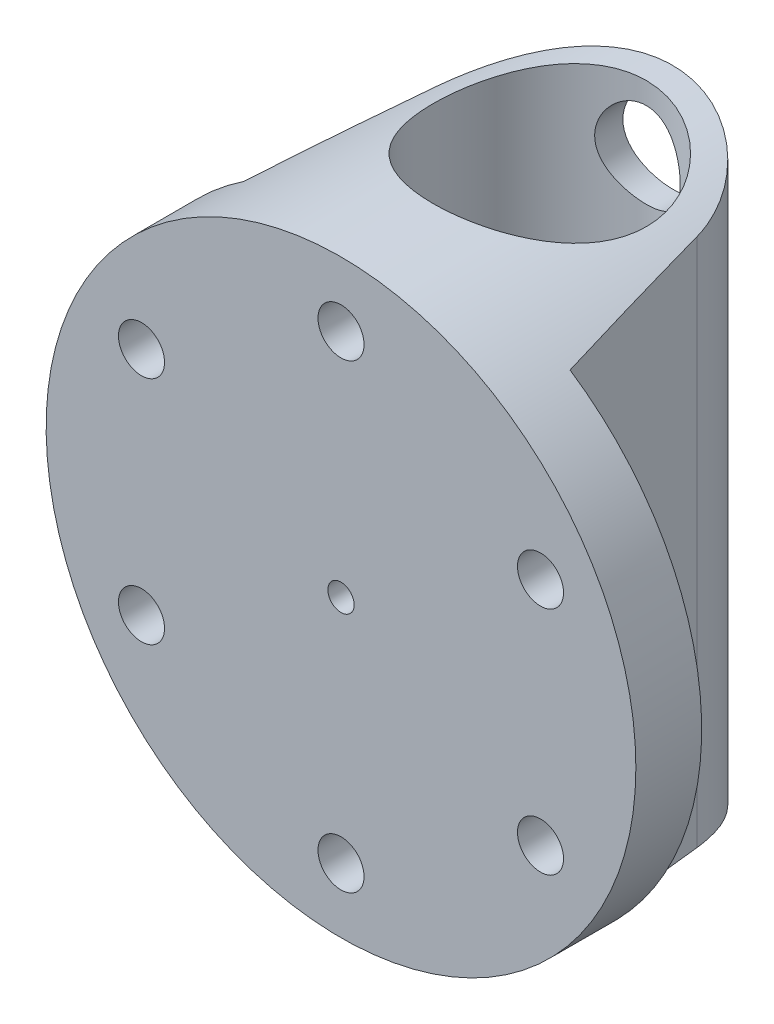
from build123d import *

# Parameters (mm, degrees)
SKETCH1_R                       = 22.4
BOSS_EXTRUDE1_DEPTH             = 5
BOSS_EXTRUDE2_REACH             = 34.071
BOSS_EXTRUDE2_END_RADIUS        = 22.4
SKETCH3_R                       = 8.1
BOSS_EXTRUDE2_DIRECTION_2_DEPTH = 18
BOSS_EXTRUDE5_START             = 21
BOSS_EXTRUDE5_DEPTH             = 21
CUT_EXTRUDE2_START              = -21
CUT_EXTRUDE2_DEPTH              = 21
SKETCH2_R                       = 1.75
CUT_EXTRUDE1_DEPTH              = 41.479130543
CUT_EXTRUDE3_DEPTH              = 21
CUT_EXTRUDE3_DEPTH_BACK         = 1.5
SKETCH7_R                       = 3.25
SKETCH7_R_2                     = 1.75
SKETCH8_R                       = 1
CUT_EXTRUDE4_DEPTH              = 41.479130543


with BuildPart() as part:
    # Sketch1 → Boss-Extrude1 (new body)
    with BuildSketch(Plane.XY):
        Circle(SKETCH1_R)
    extrude(amount=BOSS_EXTRUDE1_DEPTH)



with BuildPart() as body_2:
    # Boss-Extrude2: up to this cylinder (the profile starts inside it)
    boss_extrude2_end = Plane(origin=(0, 0, -6.007051), z_dir=(0, 0, -1)) * Cylinder(BOSS_EXTRUDE2_END_RADIUS, 113.942, mode=Mode.PRIVATE)
    # Sketch3 → Boss-Extrude2 (new, up to the surface)
    with BuildSketch(Plane(origin=(0, 0, 0), x_dir=(1, 0, 0), z_dir=(0, 1, 0)), mode=Mode.PRIVATE) as boss_extrude2_sk1:
        with BuildLine():
            Line((-9.89110529, 12.143535207), (-12.4, 0))
            Line((-12.4, 0), (12.4, 0))
            Line((12.4, 0), (9.89110529, 12.143535207))
            ThreePointArc((9.89110529, 12.143535207), (0, 20.2), (-9.89110529, 12.143535207))
        make_face()
        with Locations(Location((0, 10.1, 0), (0, 0, 270))):
            Circle(SKETCH3_R, mode=Mode.SUBTRACT)
    boss_extrude2_tool1 = extrude(boss_extrude2_sk1.sketch, amount=BOSS_EXTRUDE2_REACH, mode=Mode.PRIVATE) & boss_extrude2_end
    add(boss_extrude2_tool1.solids().sort_by_distance((-10.832312, 0, -6.007051))[0])

    # Sketch3 → Boss-Extrude2 direction 2 (add)
    with BuildSketch(Plane(origin=(0, 0, 0), x_dir=(1, 0, 0), z_dir=(0, 1, 0))):
        with BuildLine():
            Line((-9.89110529, 12.143535207), (-12.4, 0))
            Line((-12.4, 0), (12.4, 0))
            Line((12.4, 0), (9.89110529, 12.143535207))
            ThreePointArc((9.89110529, 12.143535207), (0, 20.2), (-9.89110529, 12.143535207))
        make_face()
        with Locations(Location((0, 10.1, 0), (0, 0, 270))):
            Circle(SKETCH3_R, mode=Mode.SUBTRACT)
    extrude(amount=-BOSS_EXTRUDE2_DIRECTION_2_DEPTH)


with BuildPart() as part_1:
    add(part.part)

    add(body_2.part)  # Boss-Extrude5 merges body 2
    # Sketch4 → Boss-Extrude5 (add)
    with BuildSketch(Plane(origin=(0, 0, 0), x_dir=(-1, 0, 0), z_dir=(0, 0, -1)).offset(BOSS_EXTRUDE5_START)):
        with BuildLine():
            Line((9.89110529, -18), (12.4, -18))
            Line((12.4, -18), (12.4, -18.654758106))
            ThreePointArc((12.4, -18.654758106), (0, -22.4), (-12.4, -18.654758106))
            Line((-12.4, -18.654758106), (-12.4, -18))
            Line((-12.4, -18), (-9.89110529, -18))
            Line((-9.89110529, -18), (9.89110529, -18))
        make_face()
    extrude(amount=-BOSS_EXTRUDE5_DEPTH)

    # Sketch6 → Cut-Extrude2 (cut)
    with BuildSketch(Plane(origin=(0, -18, 0), x_dir=(1, 0, 0), z_dir=(0, 1, 0)).offset(CUT_EXTRUDE2_START)):
        with BuildLine():
            Line((9.89110529, 12.143535207), (12.4, 0))
            Line((12.4, 0), (12.4, 21))
            Line((12.4, 21), (-12.4, 21))
            Line((-12.4, 21), (-12.4, 0))
            Line((-12.4, 0), (-9.89110529, 12.143535207))
            ThreePointArc((-9.89110529, 12.143535207), (0, 20.2), (9.89110529, 12.143535207))
        make_face()
    extrude(amount=CUT_EXTRUDE2_DEPTH, mode=Mode.SUBTRACT)

    # Sketch2 → Cut-Extrude1 (cut, through all)
    with BuildSketch(Plane.XY.offset(5)):
        with Locations((0, 17.5)):
            Circle(SKETCH2_R)
        with Locations((15.155444566, 8.75)):
            Circle(SKETCH2_R)
        with Locations((15.155444566, -8.75)):
            Circle(SKETCH2_R)
        with Locations((0, -17.5)):
            Circle(SKETCH2_R)
        with Locations((-15.155444566, -8.75)):
            Circle(SKETCH2_R)
        with Locations((-15.155444566, 8.75)):
            Circle(SKETCH2_R)
    extrude(amount=-CUT_EXTRUDE1_DEPTH, mode=Mode.SUBTRACT)

    # Sketch7 → Cut-Extrude3 (cut, two sides: drawn at the far end of the back side and taken through both)
    # profile 1 of 2: a face of its own
    with BuildSketch(Plane(origin=(0, 0, 0), x_dir=(-1, 0, 0), z_dir=(0, 0, -1)).offset(-CUT_EXTRUDE3_DEPTH_BACK)):
        with Locations(Location((0, 17.5, 0), (0, 0, 188.849872023))):
            Circle(SKETCH7_R)
        with Locations(Location((0, 17.5, 0), (0, 0, 180))):
            Circle(SKETCH7_R_2, mode=Mode.SUBTRACT)
    # profile 2 of 2: a face of its own
    with BuildSketch(Plane(origin=(0, 0, 0), x_dir=(-1, 0, 0), z_dir=(0, 0, -1)).offset(-CUT_EXTRUDE3_DEPTH_BACK)):
        with Locations(Location((0, -17.5, 0), (0, 0, 180))):
            Circle(SKETCH7_R)
        with Locations(Location((0, -17.5, 0), (0, 0, 180))):
            Circle(SKETCH7_R_2, mode=Mode.SUBTRACT)
    extrude(amount=CUT_EXTRUDE3_DEPTH + CUT_EXTRUDE3_DEPTH_BACK, mode=Mode.SUBTRACT)

    # Sketch8 → Cut-Extrude4 (cut, through all)
    with BuildSketch(Plane.XY.offset(5)):
        Circle(SKETCH8_R)
    extrude(amount=-CUT_EXTRUDE4_DEPTH, mode=Mode.SUBTRACT)


solid = part_1.part
